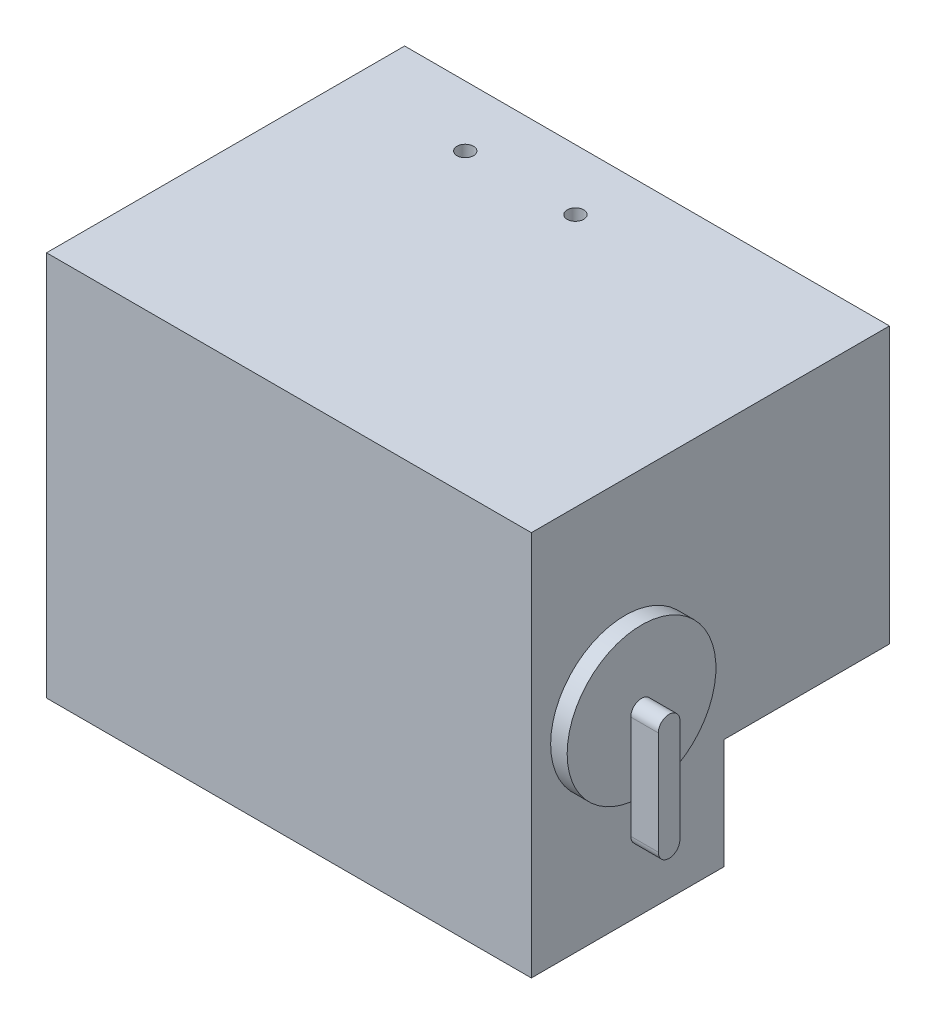
from build123d import *

# Parameters (mm, degrees)
SKETCH_1_W          = 88
SKETCH_1_H          = 70
EXTRUDE_1_DEPTH     = 35
SKETCH_3_W          = 88
SKETCH_3_H          = 50
EXTRUDE_2_DEPTH     = 30
SKETCH_6_R          = 13.5
EXTRUDE_3_DEPTH     = 3
EXTRUDE_4_DEPTH     = 5
CUT_EXTRUDE_1_REACH = 95.963
SKETCH_8_R          = 1.5


with BuildPart() as part:
    # 草图1 → 凸台-拉伸1 (new body)
    with BuildSketch(Plane.XY):
        Rectangle(SKETCH_1_W, SKETCH_1_H)
    extrude(amount=EXTRUDE_1_DEPTH)

    # 草图3 → 凸台-拉伸2 (add)
    with BuildSketch(Plane(origin=(0, 0, 0), x_dir=(-1, 0, 0), z_dir=(0, 0, -1))):
        with Locations((0, 10)):
            Rectangle(SKETCH_3_W, SKETCH_3_H)
    extrude(amount=EXTRUDE_2_DEPTH)

    # 草图6 → 凸台-拉伸3 (add)
    with BuildSketch(Plane(origin=(44, 0, 0), x_dir=(0, 0, -1), z_dir=(1, 0, 0))):
        with Locations(Location((-18, 0, 0), (0, 0, 180))):
            Circle(SKETCH_6_R)
    extrude(amount=EXTRUDE_3_DEPTH)

    # 草图7 → 凸台-拉伸4 (add)
    with BuildSketch(Plane(origin=(47, 0, 0), x_dir=(0, 0, -1), z_dir=(1, 0, 0))):
        with BuildLine():
            Line((-16.042793618, 0), (-16.042793618, -18.740555958))
            ThreePointArc((-16.042793618, -18.740555958), (-18, -20.697762339), (-19.957206382, -18.740555958))
            Line((-19.957206382, -18.740555958), (-19.957206382, 0))
            ThreePointArc((-19.957206382, 0), (-18, 1.957206382), (-16.042793618, 0))
        make_face()
    extrude(amount=EXTRUDE_4_DEPTH)

    # 草图8 → 切除-拉伸1 (cut, up to next)
    with BuildSketch(Plane(origin=(0, 35, 0), x_dir=(1, 0, 0), z_dir=(0, 1, 0)), mode=Mode.PRIVATE) as cut_extrude_1_sk1:
        with Locations(Location((-22, 19, 0), (0, 0, 270))):
            Circle(SKETCH_8_R)
    cut_extrude_1_tool1 = extrude(cut_extrude_1_sk1.sketch, amount=-CUT_EXTRUDE_1_REACH, mode=Mode.PRIVATE) & part.part
    # 草图8 → 切除-拉伸1 (cut, up to next)
    with BuildSketch(Plane(origin=(0, 35, 0), x_dir=(1, 0, 0), z_dir=(0, 1, 0)), mode=Mode.PRIVATE) as cut_extrude_1_sk2:
        with Locations(Location((-2, 19, 0), (0, 0, 270))):
            Circle(SKETCH_8_R)
    cut_extrude_1_tool2 = extrude(cut_extrude_1_sk2.sketch, amount=-CUT_EXTRUDE_1_REACH, mode=Mode.PRIVATE) & part.part
    add(cut_extrude_1_tool1.solids().sort_by_distance((-22, 35, -19))[0], mode=Mode.SUBTRACT)
    add(cut_extrude_1_tool2.solids().sort_by_distance((-2, 35, -19))[0], mode=Mode.SUBTRACT)


solid = part.part
